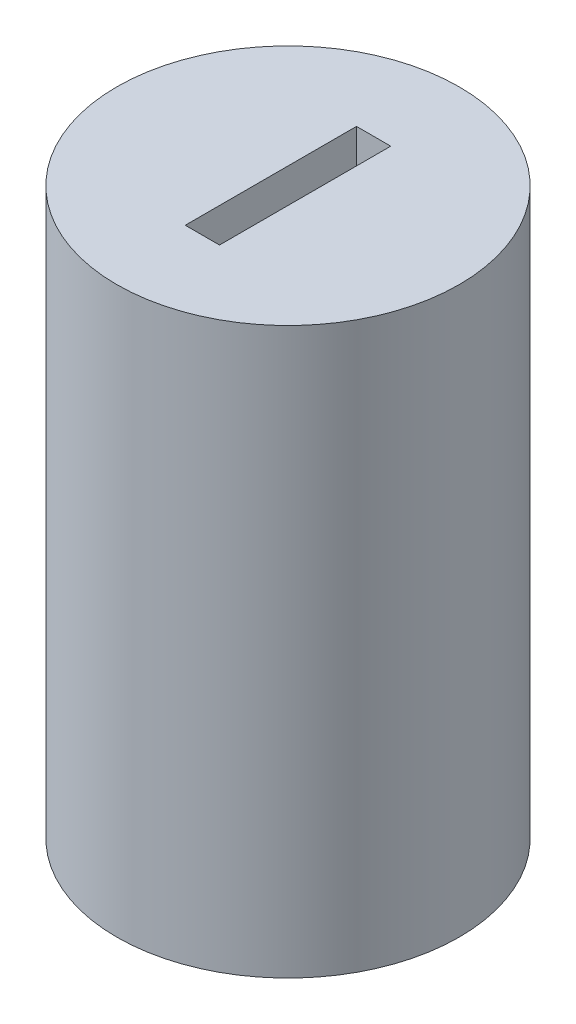
from build123d import *

# Parameters (mm, degrees)
ESBO_O1_R                = 5
RESSALTO_EXTRUS_O1_DEPTH = 1
ESBO_O3_R                = 5
RESSALTO_EXTRUS_O3_DEPTH = 15
CORTE_EXTRUS_O2_START    = -15
ESBO_O4_R                = 4.75
CORTE_EXTRUS_O2_DEPTH    = 15
ESBO_O5_R                = 5
RESSALTO_EXTRUS_O4_DEPTH = 1
ESBO_O6_W                = 1
ESBO_O6_H                = 5
CORTE_EXTRUS_O3_DEPTH    = 1


with BuildPart() as part:
    # Esboço1 → Ressalto-extrusão1 (new body)
    with BuildSketch(Plane(origin=(0, 0, 0), x_dir=(1, 0, 0), z_dir=(0, 1, 0))):
        with Locations(Location((0, 0, 0), (0, 0, 270))):
            Circle(ESBO_O1_R)
    extrude(amount=RESSALTO_EXTRUS_O1_DEPTH)

    # Esboço3 → Ressalto-extrusão3 (add)
    with BuildSketch(Plane(origin=(0, 0.5, 0), x_dir=(1, 0, 0), z_dir=(0, 1, 0))):
        with Locations(Location((0, 0, 0), (0, 0, 270))):
            Circle(ESBO_O3_R)
    extrude(amount=RESSALTO_EXTRUS_O3_DEPTH)

    # Esboço4 → Corte-extrusão2 (cut)
    with BuildSketch(Plane(origin=(0, 15.5, 0), x_dir=(1, 0, 0), z_dir=(0, 1, 0)).offset(CORTE_EXTRUS_O2_START)):
        with Locations(Location((0, 0, 0), (0, 0, 270))):
            Circle(ESBO_O4_R)
    extrude(amount=CORTE_EXTRUS_O2_DEPTH, mode=Mode.SUBTRACT)

    # Esboço5 → Ressalto-extrusão4 (add)
    with BuildSketch(Plane(origin=(0, 15.5, 0), x_dir=(1, 0, 0), z_dir=(0, 1, 0))):
        with Locations(Location((0, 0, 0), (0, 0, 270))):
            Circle(ESBO_O5_R)
    extrude(amount=RESSALTO_EXTRUS_O4_DEPTH)

    # Esboço6 → Corte-extrusão3 (cut)
    with BuildSketch(Plane(origin=(0, 16.5, 0), x_dir=(1, 0, 0), z_dir=(0, 1, 0))):
        Rectangle(ESBO_O6_W, ESBO_O6_H)
    extrude(amount=-CORTE_EXTRUS_O3_DEPTH, mode=Mode.SUBTRACT)


solid = part.part
